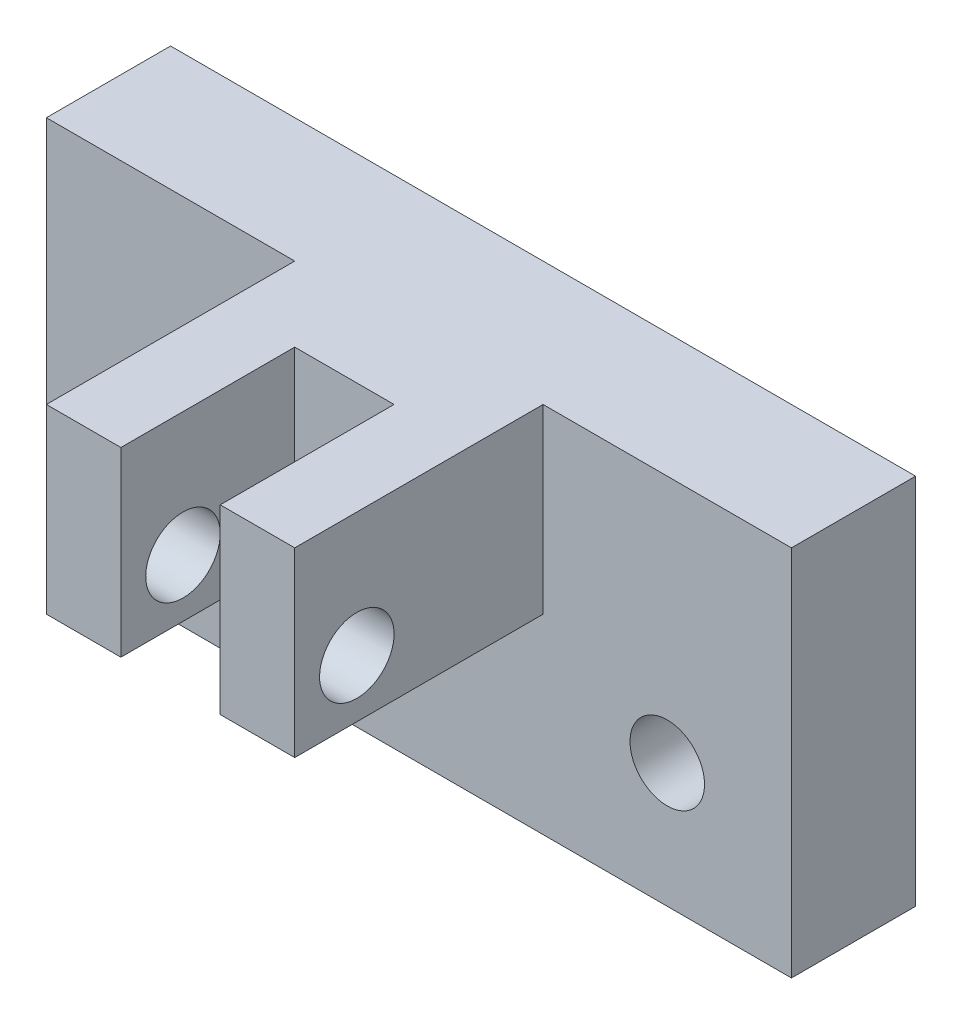
from build123d import *

# Parameters (mm, degrees)
SKETCH_1_W          = 30
SKETCH_1_H          = 15
EXTRUDE_1_DEPTH     = 5
SKETCH_2_W          = 10
SKETCH_2_H          = 7.314170724
EXTRUDE_2_DEPTH     = 10
SKETCH_3_R          = 1.5
CUT_EXTRUDE_1_DEPTH = 6.5
SKETCH_4_W          = 4
SKETCH_4_H          = 7.314170724
CUT_EXTRUDE_2_DEPTH = 7
SKETCH_5_R          = 1.5
CUT_EXTRUDE_3_DEPTH = 15


with BuildPart() as part:
    # 草图1 → 凸台-拉伸1 (new body)
    with BuildSketch(Plane.XY):
        with Locations((15, 7.5)):
            Rectangle(SKETCH_1_W, SKETCH_1_H)
    extrude(amount=EXTRUDE_1_DEPTH)

    # 草图2 → 凸台-拉伸2 (add)
    with BuildSketch(Plane.XY.offset(5)):
        with Locations((15, 11.342914638)):
            Rectangle(SKETCH_2_W, SKETCH_2_H)
    extrude(amount=EXTRUDE_2_DEPTH)

    # 草图3 → 切除-拉伸1 (cut)
    with BuildSketch(Plane.XY.offset(5)):
        with Locations((5, 5)):
            Circle(SKETCH_3_R)
        with Locations((25, 5)):
            Circle(SKETCH_3_R)
    extrude(amount=-CUT_EXTRUDE_1_DEPTH, mode=Mode.SUBTRACT)

    # 草图4 → 切除-拉伸2 (cut)
    with BuildSketch(Plane.XY.offset(15)):
        with Locations((15, 11.342914638)):
            Rectangle(SKETCH_4_W, SKETCH_4_H)
    extrude(amount=-CUT_EXTRUDE_2_DEPTH, mode=Mode.SUBTRACT)

    # 草图5 → 切除-拉伸3 (cut)
    with BuildSketch(Plane.ZY.offset(-10)):
        with Locations(Location((12.5, 10, 0), (0, 0, 270))):
            Circle(SKETCH_5_R)
    extrude(amount=-CUT_EXTRUDE_3_DEPTH, mode=Mode.SUBTRACT)


solid = part.part
